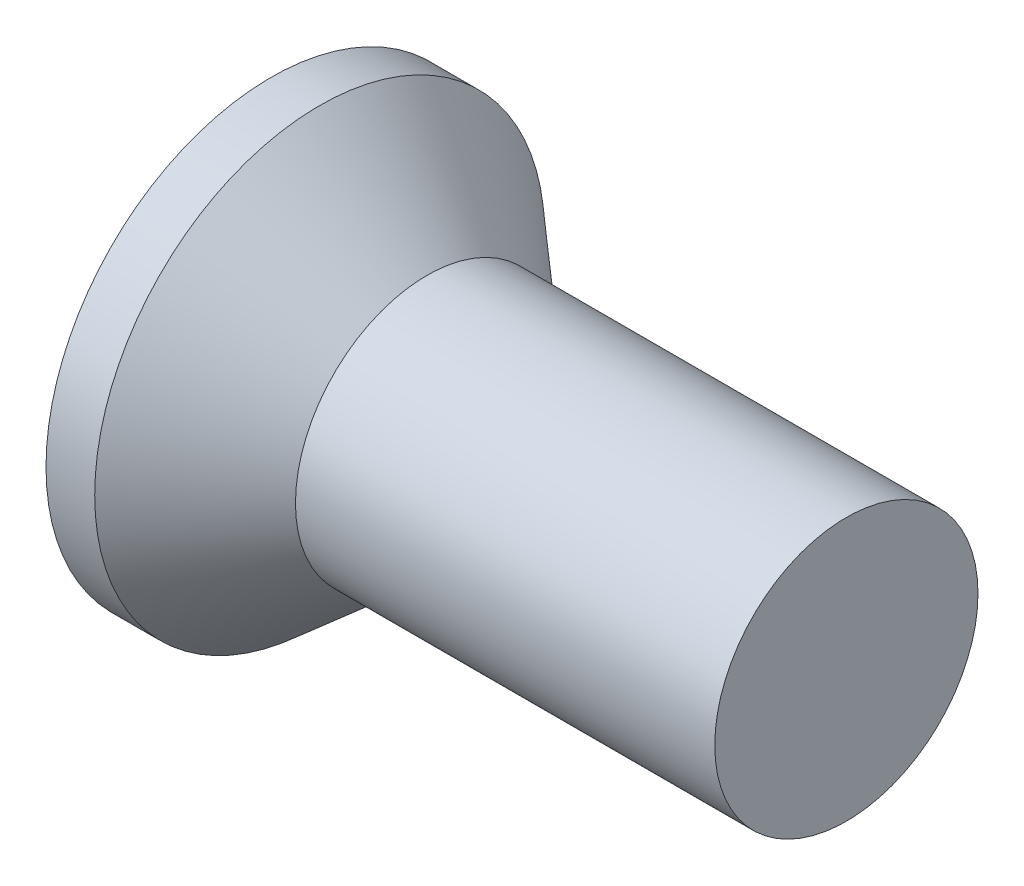
from build123d import *

# Parameters (mm, degrees)
CIRPATTERN1_COUNT = 2
CIRPATTERN1_ANGLE = 90


with BuildPart() as part:
    # BodySke → Base-Revolve (revolve)
    with BuildSketch(Plane.XY, mode=Mode.PRIVATE) as base_revolve_sk:
        Polygon((0, 0), (0, 1.8669), (0.404209595, 1.8669), (1.2954, 1.0922), (4.7752, 1.0922), (4.7752, 0), align=None)
    revolve(base_revolve_sk.sketch.rotate(Axis((-6.35, 0, 0), (1, 0, 0)), 90), axis=Axis((-6.35, 0, 0), (1, 0, 0)))

    # Sketch3 → Cross section 0
    with BuildSketch(Plane.ZY):
        with BuildLine():
            Line((-0.3429, 1.524), (0.3429, 1.524))
            Line((0.3429, 1.524), (0.3429, -1.524))
            Line((0.3429, -1.524), (-0.3429, -1.524))
            Line((-0.3429, -1.524), (-0.3429, 1.524))
        make_face()
    # Sketch4 → Cross section 1
    with BuildSketch(Plane.ZY.offset(-1.6764)):
        with BuildLine():
            Line((-0.17145, 0.17145), (0.17145, 0.17145))
            Line((0.17145, 0.17145), (0.17145, -0.17145))
            Line((0.17145, -0.17145), (-0.17145, -0.17145))
            Line((-0.17145, -0.17145), (-0.17145, 0.17145))
        make_face()
    cross = loft(mode=Mode.SUBTRACT)

    # CirPattern1: Cross ×2 about axis
    cirpattern1_axis = Axis((0, 0, 0), (1, 0, 0))
    for i in range(1, CIRPATTERN1_COUNT):
        add(cross.rotate(cirpattern1_axis, i * CIRPATTERN1_ANGLE / (CIRPATTERN1_COUNT - 1)), mode=Mode.SUBTRACT)


solid = part.part
